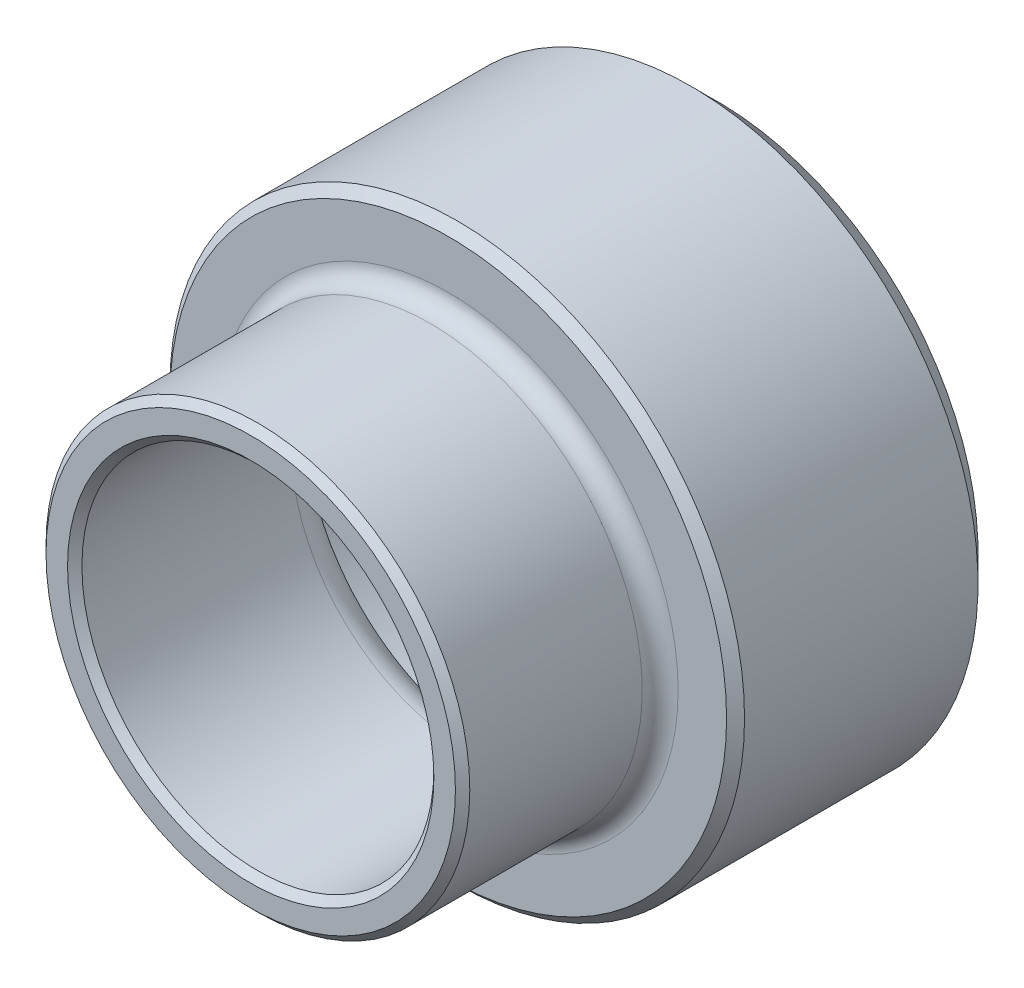
from build123d import *

# Parameters (mm, degrees)
F_12_0_12_DIAMETER_HOLE1_D     = 12
F_12_0_12_DIAMETER_HOLE1_DEPTH = 5.75
F_12_0_12_DIAMETER_HOLE1_TIP   = 3.605163714
CHAMFER1_SIZE                  = 0.75
CHAMFER2_SIZE                  = 0.25
CHAMFER3_SIZE                  = 0.2
FILLET1_R                      = 1


with BuildPart() as part:
    # Sketch1 → Revolve1 (revolve)
    with BuildSketch(Plane.XZ, mode=Mode.PRIVATE) as revolve1_sk:
        with BuildLine():
            Line((5.9, 13), (4.9, 13))
            Line((4.9, 13), (4.9, 5.75))
            Line((4.9, 5.75), (0, 5.75))
            Line((0, 5.75), (0, 0))
            Line((0, 0), (8, 0))
            Line((8, 0), (8, 7.5))
            Line((8, 7.5), (6.4, 7.5))
            ThreePointArc((6.4, 7.5), (6.046446609, 7.646446609), (5.9, 8))
            Line((5.9, 8), (5.9, 13))
        make_face()
    revolve(revolve1_sk.sketch.rotate(Axis((0, 0, 13), (0, 0, -1)), 180), axis=Axis((0, 0, 13), (0, 0, -1)))

    # Ø12.0 (12) Diameter Hole1
    with Locations(Plane(origin=(0, 0, 0), x_dir=(-1, 0, 0), z_dir=(0, 0, -1))):
        with Locations((0, 0)):
            Hole(F_12_0_12_DIAMETER_HOLE1_D / 2, depth=F_12_0_12_DIAMETER_HOLE1_DEPTH)
            with Locations((0, 0, -(F_12_0_12_DIAMETER_HOLE1_DEPTH + F_12_0_12_DIAMETER_HOLE1_TIP / 2))):  # 118° drill point
                Cone(0, F_12_0_12_DIAMETER_HOLE1_D / 2, F_12_0_12_DIAMETER_HOLE1_TIP, mode=Mode.SUBTRACT)

    # Chamfer1
    chamfer1_edges = [part.edges().sort_by_distance(p)[0] for p in [
        (8, 0, 0),
    ]]
    chamfer(chamfer1_edges, length=CHAMFER1_SIZE)

    # Chamfer2
    chamfer2_edges = [part.edges().sort_by_distance(p)[0] for p in [
        (8, 0, 7.5),
    ]]
    chamfer(chamfer2_edges, length=CHAMFER2_SIZE)

    # Chamfer3
    chamfer3_edges = [part.edges().sort_by_distance(p)[0] for p in [
        (-6, 0, 0),
        (5.9, 0, 13),
        (4.9, 0, 13),
    ]]
    chamfer(chamfer3_edges, length=CHAMFER3_SIZE)

    # Fillet1
    fillet1_edges = [part.edges().sort_by_distance(p)[0] for p in [
        (4.9, 0, 6.410946681),
    ]]
    fillet(fillet1_edges, radius=FILLET1_R)


solid = part.part
